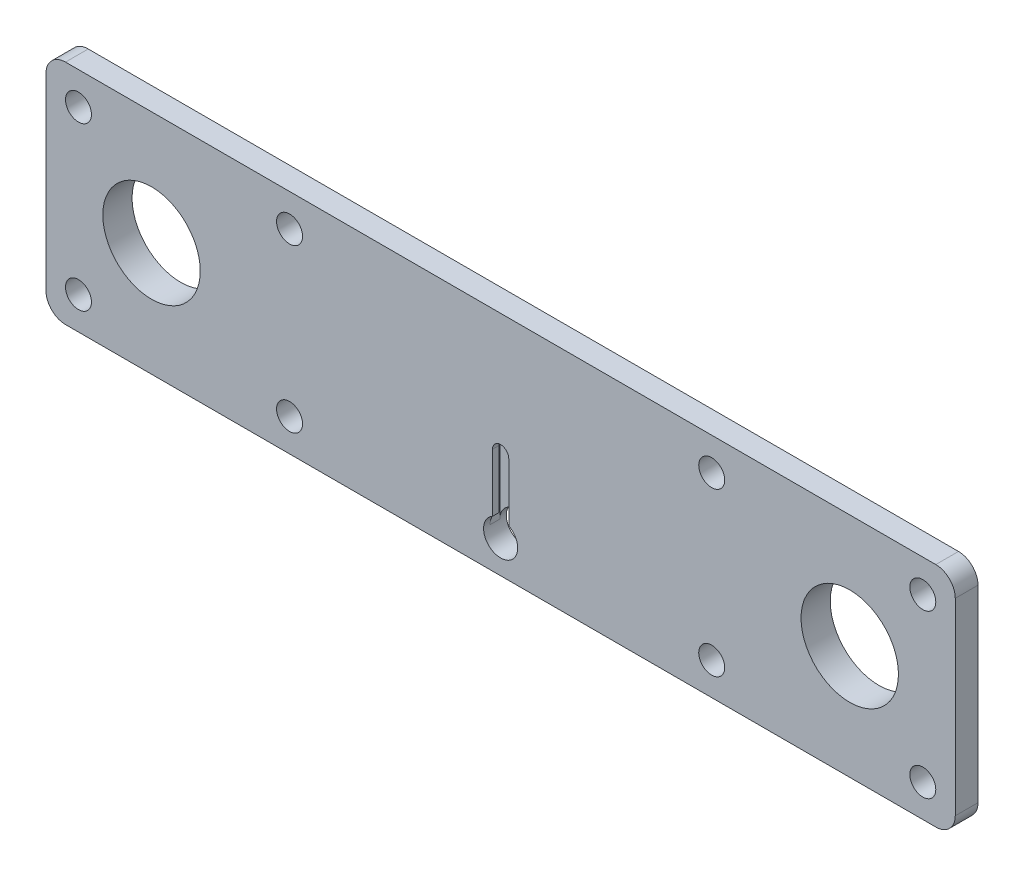
from build123d import *

# Parameters (mm, degrees)
SKETCH1_W           = 280
SKETCH1_H           = 70
BOSS_EXTRUDE1_DEPTH = 7
FILLET1_R           = 6
SKETCH2_R           = 15
SKETCH2_R_2         = 4
CUT_EXTRUDE1_DEPTH  = 10
BOSS_EXTRUDE2_START = 2
SKETCH3_R           = 20
SKETCH3_R_2         = 15
BOSS_EXTRUDE2_DEPTH = 2
CUT_EXTRUDE2_DEPTH  = 3


with BuildPart() as part:
    # Sketch1 → Boss-Extrude1 (new body)
    with BuildSketch(Plane.XY):
        Rectangle(SKETCH1_W, SKETCH1_H)
    extrude(amount=BOSS_EXTRUDE1_DEPTH)

    # Fillet1
    fillet1_edges = [part.edges().sort_by_distance(p)[0] for p in [
        (140, -35, 3.5),
        (-140, -35, 3.5),
        (-140, 35, 3.5),
        (140, 35, 3.5),
    ]]
    fillet(fillet1_edges, radius=FILLET1_R)

    # Sketch2 → Cut-Extrude1 (cut)
    with BuildSketch(Plane(origin=(0, 0, 0), x_dir=(-1, 0, 0), z_dir=(0, 0, -1))):
        with Locations((-107.5, 0)):
            Circle(SKETCH2_R)
        with Locations((107.5, 0)):
            Circle(SKETCH2_R)
        with Locations((130, 25)):
            Circle(SKETCH2_R_2)
        with Locations((65, 25)):
            Circle(SKETCH2_R_2)
        with Locations((-65, 25)):
            Circle(SKETCH2_R_2)
        with Locations((-130, 25)):
            Circle(SKETCH2_R_2)
        with Locations(Location((-130, -25, 0), (0, 0, 180))):
            Circle(SKETCH2_R_2)
        with Locations(Location((-65, -25, 0), (0, 0, 180))):
            Circle(SKETCH2_R_2)
        with Locations(Location((65, -25, 0), (0, 0, 180))):
            Circle(SKETCH2_R_2)
        with Locations(Location((130, -25, 0), (0, 0, 180))):
            Circle(SKETCH2_R_2)
        with BuildLine():
            Line((2.5, -2.5), (2.5, -20.383453672))
            ThreePointArc((2.5, -20.383453672), (0, -30.25), (-2.5, -20.383453672))
            Line((-2.5, -20.383453672), (-2.5, -2.5))
            ThreePointArc((-2.5, -2.5), (0, 0), (2.5, -2.5))
        make_face()
    extrude(amount=-CUT_EXTRUDE1_DEPTH, mode=Mode.SUBTRACT)

    # Sketch3 → Boss-Extrude2 (add)
    # profile 1 of 2: a face of its own
    with BuildSketch(Plane(origin=(0, 0, 0), x_dir=(-1, 0, 0), z_dir=(0, 0, -1)).offset(BOSS_EXTRUDE2_START)):
        with Locations(Location((-107.5, 0, 0), (0, 0, 180))):
            Circle(SKETCH3_R)
        with Locations((-107.5, 0)):
            Circle(SKETCH3_R_2, mode=Mode.SUBTRACT)
    # profile 2 of 2: a face of its own
    with BuildSketch(Plane(origin=(0, 0, 0), x_dir=(-1, 0, 0), z_dir=(0, 0, -1)).offset(BOSS_EXTRUDE2_START)):
        with Locations(Location((107.5, 0, 0), (0, 0, 180))):
            Circle(SKETCH3_R)
        with Locations((107.5, 0)):
            Circle(SKETCH3_R_2, mode=Mode.SUBTRACT)
    extrude(amount=-BOSS_EXTRUDE2_DEPTH)

    # Sketch4 → Cut-Extrude2 (cut)
    with BuildSketch(Plane(origin=(0, 0, 2), x_dir=(-1, 0, 0), z_dir=(0, 0, -1))):
        with BuildLine():
            Line((0, -25), (5.25, -25))
            Line((5.25, -25), (5.25, -2.5))
            ThreePointArc((5.25, -2.5), (0, 2.75), (-5.25, -2.5))
            Line((-5.25, -2.5), (-5.25, -25))
            Line((-5.25, -25), (0, -25))
        make_face()
    extrude(amount=-CUT_EXTRUDE2_DEPTH, mode=Mode.SUBTRACT)


solid = part.part
